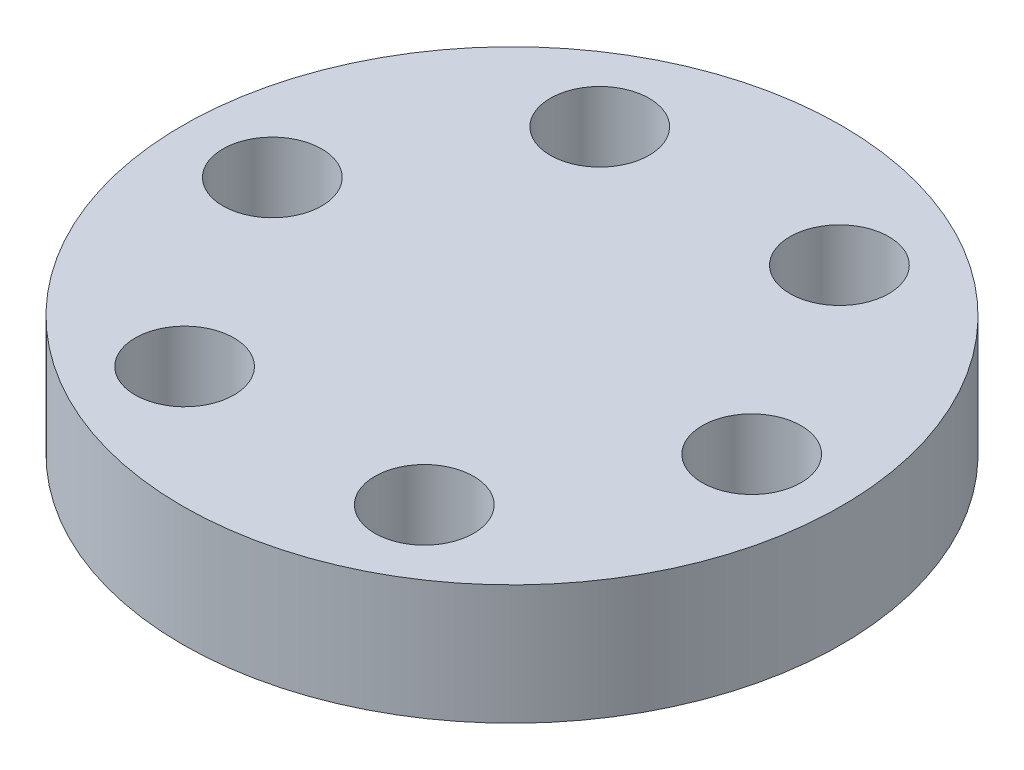
from build123d import *

# Parameters (mm, degrees)
SKETCH1_R           = 11
SKETCH1_R_2         = 1.65
BOSS_EXTRUDE1_DEPTH = 4


with BuildPart() as part:
    # Sketch1 → Boss-Extrude1 (new body)
    with BuildSketch(Plane(origin=(0, 0, 0), x_dir=(1, 0, 0), z_dir=(0, 1, 0))):
        with Locations(Location((0, 0, 0), (0, 0, 270))):
            Circle(SKETCH1_R)
        with Locations(Location((-4, 6.92820323, 0), (0, 0, 270))):
            Circle(SKETCH1_R_2, mode=Mode.SUBTRACT)
        with Locations(Location((4, 6.92820323, 0), (0, 0, 270))):
            Circle(SKETCH1_R_2, mode=Mode.SUBTRACT)
        with Locations(Location((8, 0, 0), (0, 0, 270))):
            Circle(SKETCH1_R_2, mode=Mode.SUBTRACT)
        with Locations(Location((4, -6.92820323, 0), (0, 0, 270))):
            Circle(SKETCH1_R_2, mode=Mode.SUBTRACT)
        with Locations(Location((-4, -6.92820323, 0), (0, 0, 270))):
            Circle(SKETCH1_R_2, mode=Mode.SUBTRACT)
        with Locations(Location((-8, 0, 0), (0, 0, 270))):
            Circle(SKETCH1_R_2, mode=Mode.SUBTRACT)
    extrude(amount=BOSS_EXTRUDE1_DEPTH)


solid = part.part
